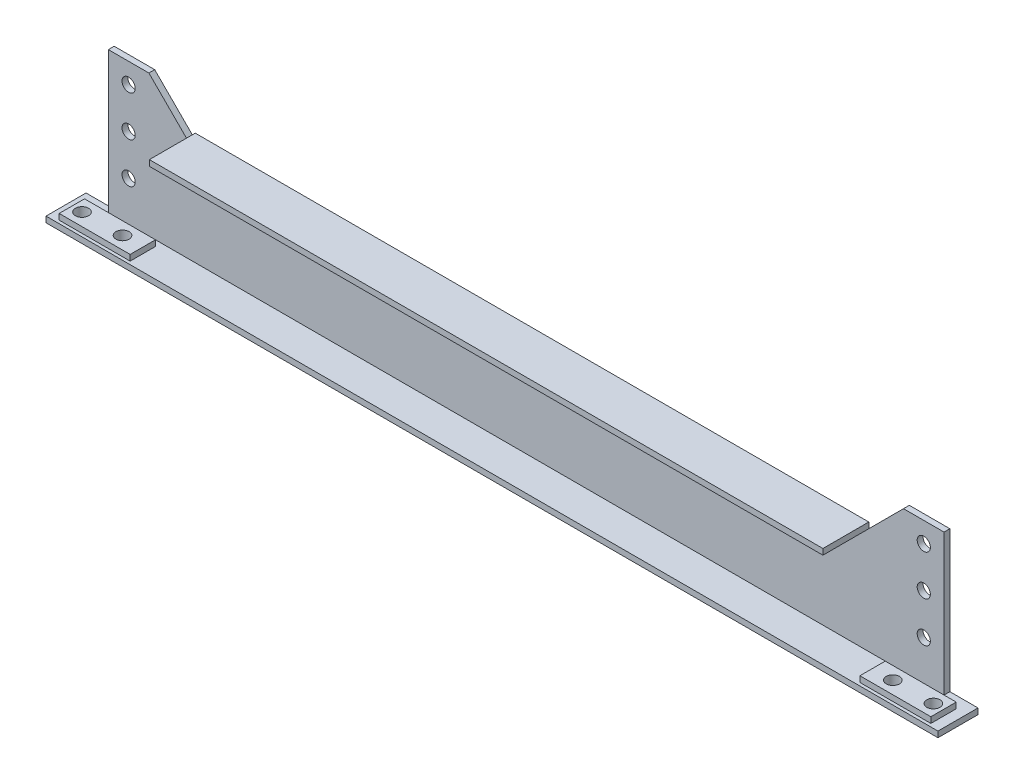
from build123d import *

# Parameters (mm, degrees)
SKETCH_1_R           = 13
EXTRUDE_591_DEPTH    = 11.5
EXTRUDE_7_DEPTH      = 79
EXTRUDE_7_DEPTH_BACK = 11.5
SKETCH_2_W           = 1329
SKETCH_2_H           = 11.5
EXTRUDE_9_DEPTH      = 67.5
EXTRUDE_9_DEPTH_BACK = 11.5
SKETCH_3_W           = 1760
SKETCH_3_H           = 11.5
SKETCH_4_W           = 140
SKETCH_4_H           = 50
EXTRUDE_10_DEPTH     = 11.5
SKETCH_6_R           = 13
CUT_EXTRUDE_1_DEPTH  = 931.962002447


with BuildPart() as part:
    # 草图1 → Extrude 591 (new body)
    with BuildSketch(Plane.XY):
        Polygon((-744.5, 139.25), (-664.5, 59.25), (664.5, 59.25), (744.5, 139.25), (824.5, 139.25), (824.5, -139.25), (-824.5, -139.25), (-824.5, 139.25), align=None)
        with Locations((-784.5, 99.25)):
            Circle(SKETCH_1_R, mode=Mode.SUBTRACT)
        with Locations((-784.5, 19.25)):
            Circle(SKETCH_1_R, mode=Mode.SUBTRACT)
        with Locations((-784.5, -60.75)):
            Circle(SKETCH_1_R, mode=Mode.SUBTRACT)
        with Locations(Location((784.5, -60.75, 0), (0, 0, 180))):
            Circle(SKETCH_1_R, mode=Mode.SUBTRACT)
        with Locations(Location((784.5, 19.25, 0), (0, 0, 180))):
            Circle(SKETCH_1_R, mode=Mode.SUBTRACT)
        with Locations(Location((784.5, 99.25, 0), (0, 0, 180))):
            Circle(SKETCH_1_R, mode=Mode.SUBTRACT)
    extrude(amount=EXTRUDE_591_DEPTH)

    # 草图2 → 凸台-拉伸7 (add, two sides: drawn at the far end of the back side and taken through both)
    with BuildSketch(Plane.XY.offset(11.5).offset(-EXTRUDE_7_DEPTH_BACK)):
        with Locations((0, 65)):
            Rectangle(SKETCH_2_W, SKETCH_2_H)
    extrude(amount=EXTRUDE_7_DEPTH + EXTRUDE_7_DEPTH_BACK)

    # 草图3 → 凸台-拉伸9 (add, two sides: drawn at the far end of the back side and taken through both)
    with BuildSketch(Plane.XY.offset(11.5).offset(-EXTRUDE_9_DEPTH_BACK)):
        with Locations((0, -145)):
            Rectangle(SKETCH_3_W, SKETCH_3_H)
    extrude(amount=EXTRUDE_9_DEPTH + EXTRUDE_9_DEPTH_BACK)

    # 草图4 → 凸台-拉伸10 (add)
    with BuildSketch(Plane(origin=(0, -139.25, 0), x_dir=(-1, 0, 0), z_dir=(0, 1, 0))):
        with Locations((-790, 48)):
            Rectangle(SKETCH_4_W, SKETCH_4_H)
        with Locations((790, 48)):
            Rectangle(SKETCH_4_W, SKETCH_4_H)
    extrude(amount=EXTRUDE_10_DEPTH)

    # 草图6 → 切除-拉伸1 (cut, through all)
    with BuildSketch(Plane.XZ.offset(150.75)):
        with Locations((-840, 48)):
            Circle(SKETCH_6_R)
        with Locations((-760, 48)):
            Circle(SKETCH_6_R)
        with Locations(Location((760, 48, 0), (0, 0, 180))):
            Circle(SKETCH_6_R)
        with Locations(Location((840, 48, 0), (0, 0, 180))):
            Circle(SKETCH_6_R)
    extrude(amount=-CUT_EXTRUDE_1_DEPTH, mode=Mode.SUBTRACT)


solid = part.part
